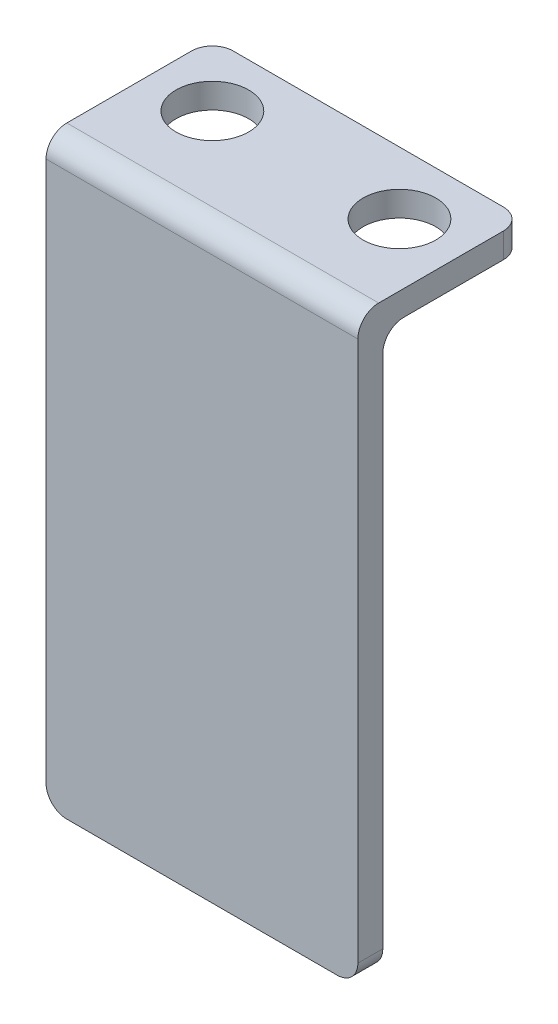
from build123d import *

# Parameters (mm, degrees)
EXTRUDE_1_DEPTH             = 15
HOLE_WIZARD_3_5_3_5_1_D     = 3.5
HOLE_WIZARD_3_5_3_5_1_DEPTH = 4
FILLET_1_R                  = 1
FILLET_2_R                  = 1


with BuildPart() as part:
    # 草图5 → 拉伸-薄壁1 (new body)
    with BuildSketch(Plane(origin=(0, 0, 0), x_dir=(0, 0, -1), z_dir=(1, 0, 0))):
        Polygon((0, -28), (0, 0), (8, 0), (8, -1.2), (1.2, -1.2), (1.2, -28), align=None)
    extrude(amount=EXTRUDE_1_DEPTH)

    # Ø3.5 (3.5) 直径孔1
    with Locations(Plane(origin=(4.305374672, 0, -7.219790434), x_dir=(1, 0, 0), z_dir=(0, 1, 0))):
        with Locations((7.694625328, -2.219790434), (-1.305374672, -2.219790434)):
            Hole(HOLE_WIZARD_3_5_3_5_1_D / 2, depth=HOLE_WIZARD_3_5_3_5_1_DEPTH)

    # 圆角1
    fillet_1_edges = [part.edges().sort_by_distance(p)[0] for p in [
        (15, -28, -0.6),
        (0, -28, -0.6),
        (0, -0.6, -8),
        (15, -0.6, -8),
    ]]
    fillet(fillet_1_edges, radius=FILLET_1_R)

    # 圆角2
    fillet_2_edges = [part.edges().sort_by_distance(p)[0] for p in [
        (7.5, -1.2, -1.2),
        (7.5, 0, 0),
    ]]
    fillet(fillet_2_edges, radius=FILLET_2_R)


solid = part.part
